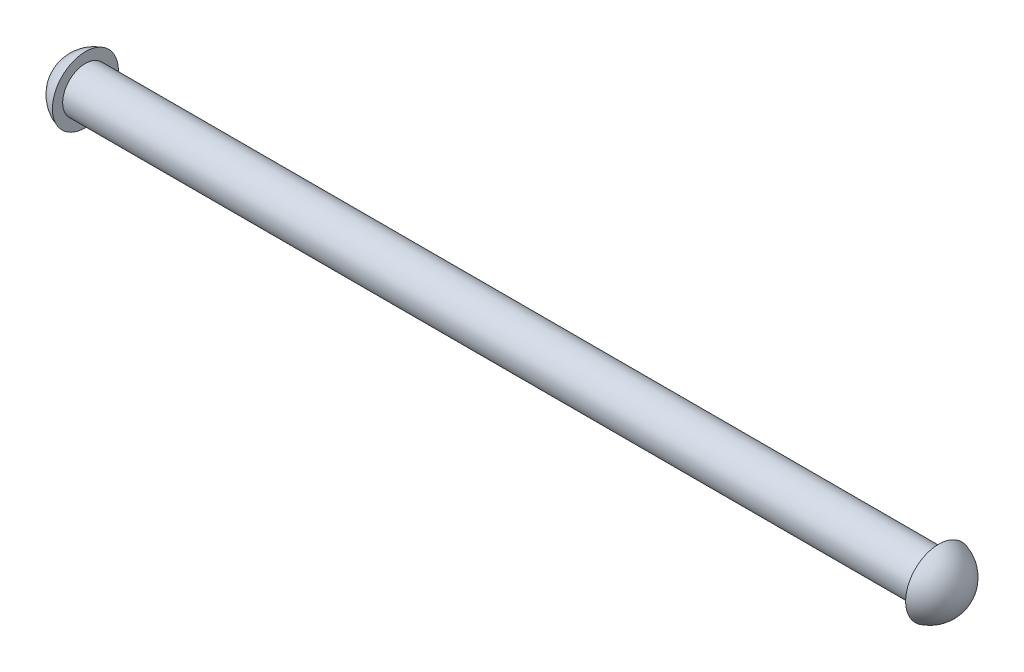
from build123d import *


with BuildPart() as part:
    # Sketch1 → Revolve1 (revolve)
    with BuildSketch(Plane.XY, mode=Mode.PRIVATE) as revolve1_sk:
        with BuildLine():
            Line((-37.5, 2), (-37.5, 2.9))
            ThreePointArc((-37.5, 2.9), (-39.109315101, 1.829707118), (-39.731885425, 0))
            Line((-39.731885425, 0), (-37.5, 0))
            Line((-37.5, 0), (37.5, 0))
            Line((37.5, 0), (39.731885425, 0))
            ThreePointArc((39.731885425, 0), (39.109315101, 1.829707118), (37.5, 2.9))
            Line((37.5, 2.9), (37.5, 2))
            Line((37.5, 2), (-37.5, 2))
        make_face()
    revolve(revolve1_sk.sketch.rotate(Axis((-37.5, 0, 0), (1, 0, 0)), 90), axis=Axis((-37.5, 0, 0), (1, 0, 0)))


solid = part.part
